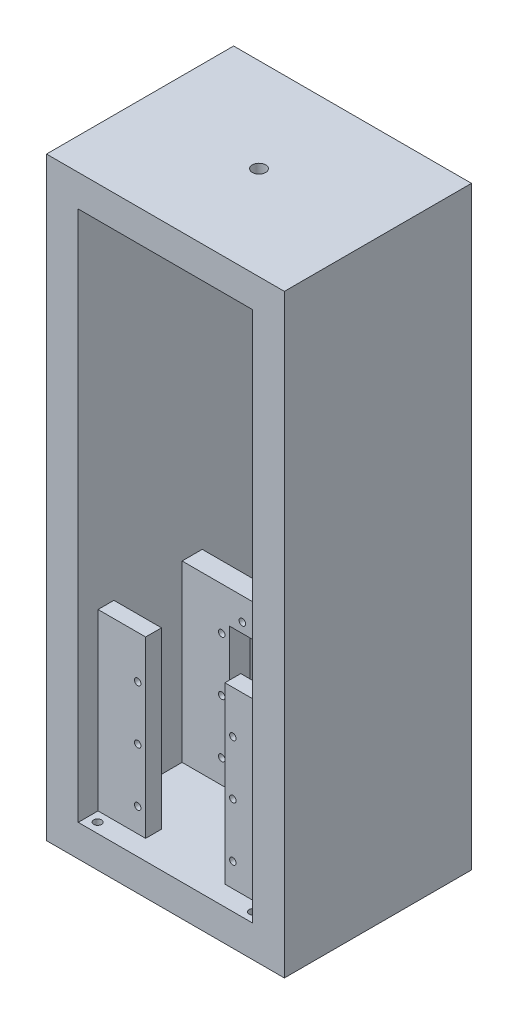
from build123d import *

# Parameters (mm, degrees)
SKETCH1_W                       = 75
SKETCH1_H                       = 187.5
SKETCH1_W_2                     = 55
SKETCH1_H_2                     = 167.5
BOSS_EXTRUDE1_DEPTH             = 59
TAP_DRILL_FOR_M5X0_8_TAP2_D     = 4.2
TAP_DRILL_FOR_M5X0_8_TAP2_DEPTH = 10
TAP_DRILL_FOR_M5X0_8_TAP3_D     = 4.2
TAP_DRILL_FOR_M5X0_8_TAP3_DEPTH = 10
TAP_DRILL_FOR_M5X0_8_TAP3_TIP   = 1.2618073
SKETCH13_W                      = 15
SKETCH13_H                      = 6.35
SKETCH13_H_2                    = 5
BOSS_EXTRUDE2_DEPTH             = 55
SKETCH14_W                      = 6.35
SKETCH14_H                      = 10.3
BOSS_EXTRUDE3_DEPTH             = 25
TAP_DRILL_FOR_M2_5X0_45_TAP1_D  = 2.05
TAP_DRILL_FOR_M3X0_5_TAP1_D     = 2.5
TAP_DRILL_FOR_M3X0_5_TAP1_DEPTH = 10


with BuildPart() as part:
    # Sketch1 → Boss-Extrude1 (new body)
    with BuildSketch(Plane.XY):
        with Locations((37.5, 93.75)):
            Rectangle(SKETCH1_W, SKETCH1_H)
        with Locations((37.5, 93.75)):
            Rectangle(SKETCH1_W_2, SKETCH1_H_2, mode=Mode.SUBTRACT)
    extrude(amount=-BOSS_EXTRUDE1_DEPTH)

    # Tap Drill for M5x0.8 Tap2
    with Locations(Plane(origin=(0, 10, 0), x_dir=(1, 0, 0), z_dir=(0, 1, 0))):
        with Locations((37.5, 29.5)):
            Hole(TAP_DRILL_FOR_M5X0_8_TAP2_D / 2, depth=TAP_DRILL_FOR_M5X0_8_TAP2_DEPTH)

    # Tap Drill for M5x0.8 Tap3
    with Locations(Plane(origin=(0, 187.5, 0), x_dir=(1, 0, 0), z_dir=(0, 1, 0))):
        with Locations((37.5, 29.5)):
            Hole(TAP_DRILL_FOR_M5X0_8_TAP3_D / 2, depth=TAP_DRILL_FOR_M5X0_8_TAP3_DEPTH)
            with Locations((0, 0, -(TAP_DRILL_FOR_M5X0_8_TAP3_DEPTH + TAP_DRILL_FOR_M5X0_8_TAP3_TIP / 2))):  # 118° drill point
                Cone(0, TAP_DRILL_FOR_M5X0_8_TAP3_D / 2, TAP_DRILL_FOR_M5X0_8_TAP3_TIP, mode=Mode.SUBTRACT)

    # Sketch13 → Boss-Extrude2 (add)
    with BuildSketch(Plane(origin=(0, 10, 0), x_dir=(1, 0, 0), z_dir=(0, 1, 0))):
        with Locations((57.5, 35.925)):
            Rectangle(SKETCH13_W, SKETCH13_H)
        with Locations((17.5, 35.925)):
            Rectangle(SKETCH13_W, SKETCH13_H)
        with Locations((17.5, 8.75)):
            Rectangle(SKETCH13_W, SKETCH13_H_2)
        with Locations((57.5, 8.75)):
            Rectangle(SKETCH13_W, SKETCH13_H_2)
    extrude(amount=BOSS_EXTRUDE2_DEPTH)

    # Sketch14 → Boss-Extrude3 (add)
    with BuildSketch(Plane.ZY.offset(-50)):
        with Locations((-35.925, 59.85)):
            Rectangle(SKETCH14_W, SKETCH14_H)
    extrude(amount=BOSS_EXTRUDE3_DEPTH)

    # Tap Drill for M2.5x0.45 Tap1 (through all)
    with Locations(Plane(origin=(0, 0, -39.1), x_dir=(-1, 0, 0), z_dir=(0, 0, -1))):
        with Locations((-46, 57.8), (-52.5, 51.5), (-52.5, 34.5), (-52.5, 17.5), (-22.5, 17.5), (-22.5, 34.5), (-22.5, 51.5), (-29, 57.8)):
            Hole(TAP_DRILL_FOR_M2_5X0_45_TAP1_D / 2)

    # Tap Drill for M3x0.5 Tap1
    with Locations(Plane(origin=(0, 10, 0), x_dir=(1, 0, 0), z_dir=(0, 1, 0))):
        with Locations((13, 3.125), (62, 3.125), (60, 53), (15, 53)):
            Hole(TAP_DRILL_FOR_M3X0_5_TAP1_D / 2, depth=TAP_DRILL_FOR_M3X0_5_TAP1_DEPTH)


solid = part.part
